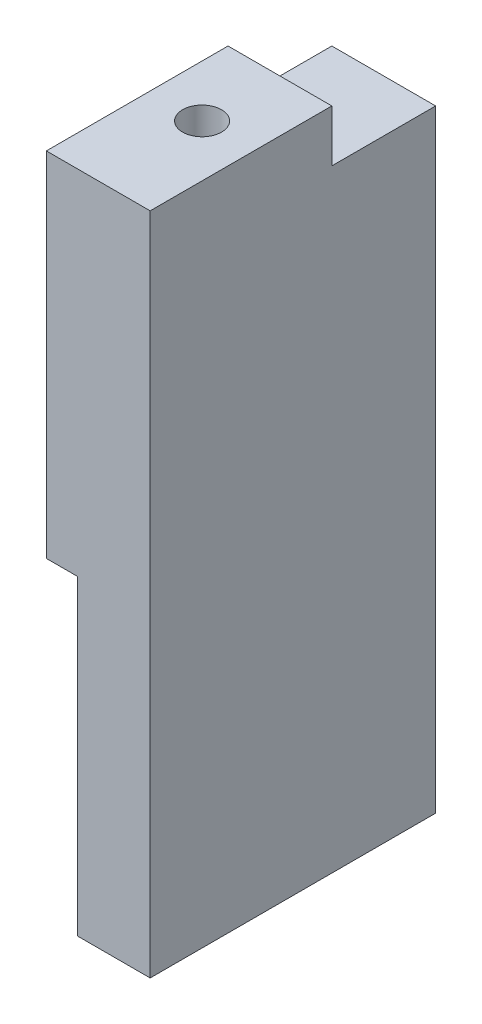
from build123d import *

# Parameters (mm, degrees)
SKETCH1_W                   = 25.4
SKETCH1_H                   = 69.85
BOSS_EXTRUDE1_DEPTH         = 162.56
SKETCH2_R                   = 4.7625
CUT_EXTRUDE1_DEPTH          = 50.8
SKETCH3_W                   = 7.62
SKETCH3_H                   = 76.2
CUT_EXTRUDE2_DEPTH          = 179.745450571
SKETCH4_W                   = 25.4
SKETCH4_H                   = 12.7
CUT_EXTRUDE3_DEPTH          = 179.745450571
F_1_4_20_TAPPED_HOLE1_D     = 5.1054
F_1_4_20_TAPPED_HOLE1_DEPTH = 22.86
F_1_4_20_TAPPED_HOLE1_TIP   = 1.533816902


with BuildPart() as part:
    # Sketch1 → Boss-Extrude1 (new body)
    with BuildSketch(Plane(origin=(0, 0, 0), x_dir=(1, 0, 0), z_dir=(0, 1, 0))):
        with Locations((12.7, 34.925)):
            Rectangle(SKETCH1_W, SKETCH1_H)
    extrude(amount=BOSS_EXTRUDE1_DEPTH)

    # Sketch2 → Cut-Extrude1 (cut)
    with BuildSketch(Plane(origin=(0, 162.56, 0), x_dir=(1, 0, 0), z_dir=(0, 1, 0))):
        with Locations(Location((12.7, 25.4, 0), (0, 0, 270))):
            Circle(SKETCH2_R)
    extrude(amount=-CUT_EXTRUDE1_DEPTH, mode=Mode.SUBTRACT)

    # Sketch3 → Cut-Extrude2 (cut, through all)
    with BuildSketch(Plane.XY):
        with Locations((3.81, 38.1)):
            Rectangle(SKETCH3_W, SKETCH3_H)
    extrude(amount=-CUT_EXTRUDE2_DEPTH, mode=Mode.SUBTRACT)

    # Sketch4 → Cut-Extrude3 (cut, through all)
    with BuildSketch(Plane(origin=(25.4, 0, 0), x_dir=(0, 0, -1), z_dir=(1, 0, 0))):
        with Locations((57.15, 156.21)):
            Rectangle(SKETCH4_W, SKETCH4_H)
    extrude(amount=-CUT_EXTRUDE3_DEPTH, mode=Mode.SUBTRACT)

    # 1/4-20 Tapped Hole1
    with Locations(Plane(origin=(0, 0, -69.85), x_dir=(-1, 0, 0), z_dir=(0, 0, -1))):
        with Locations((-17.78, 43.18), (-17.78, 12.7)):
            Hole(F_1_4_20_TAPPED_HOLE1_D / 2, depth=F_1_4_20_TAPPED_HOLE1_DEPTH)
            with Locations((0, 0, -(F_1_4_20_TAPPED_HOLE1_DEPTH + F_1_4_20_TAPPED_HOLE1_TIP / 2))):  # 118° drill point
                Cone(0, F_1_4_20_TAPPED_HOLE1_D / 2, F_1_4_20_TAPPED_HOLE1_TIP, mode=Mode.SUBTRACT)


solid = part.part
